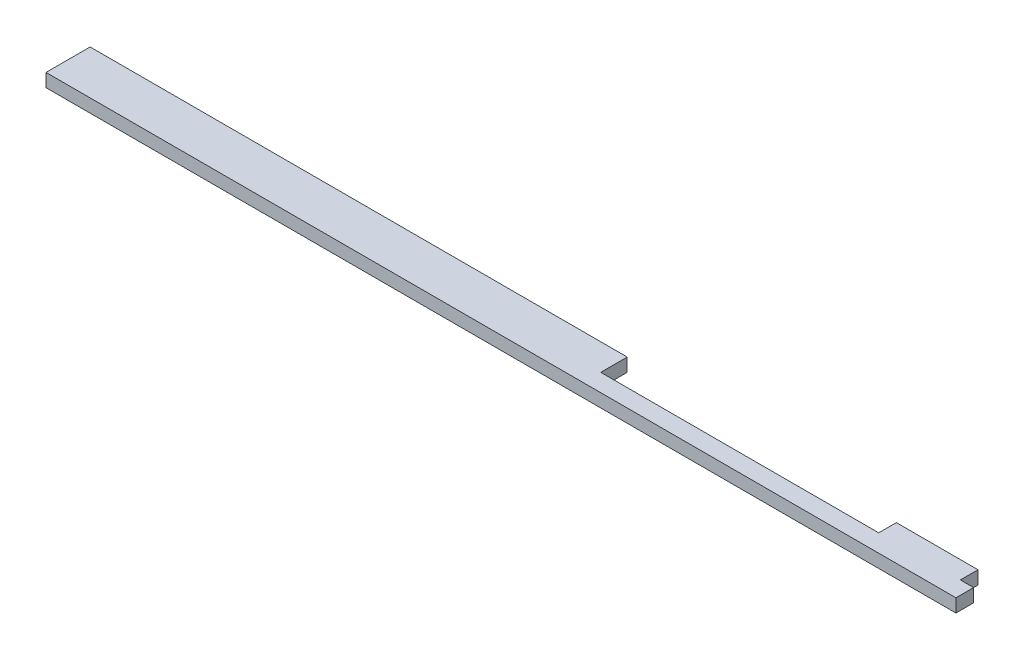
from build123d import *

# Parameters (mm, degrees)
SKETCH1_W           = 206.24
SKETCH1_H           = 10
BOSS_EXTRUDE1_DEPTH = 3
CUT_EXTRUDE1_DEPTH  = 104.284724911


with BuildPart() as part:
    # Sketch1 → Boss-Extrude1 (new body)
    with BuildSketch(Plane(origin=(0, 0, 0), x_dir=(1, 0, 0), z_dir=(0, 1, 0))):
        Rectangle(SKETCH1_W, SKETCH1_H)
    extrude(amount=BOSS_EXTRUDE1_DEPTH)

    # Sketch2 → Cut-Extrude1 (cut, through all)
    with BuildSketch(Plane(origin=(0, 3, 0), x_dir=(1, 0, 0), z_dir=(0, 1, 0))):
        Polygon((103.12, 5), (18.62, 5), (18.62, -1), (81.62, -1), (81.62, 3), (100.12, 3), (100.12, -1), (103.12, -1), align=None)
    extrude(amount=-CUT_EXTRUDE1_DEPTH, mode=Mode.SUBTRACT)


solid = part.part
